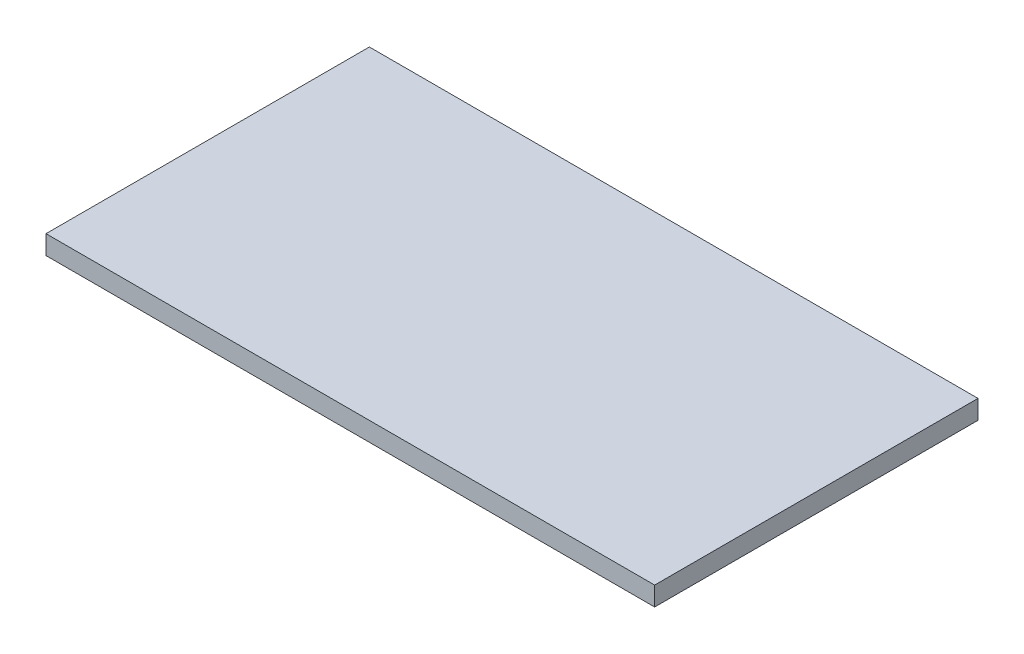
from build123d import *

# Parameters (mm, degrees)
SKIZZE1_W                       = 320
SKIZZE1_H                       = 170
AUFSATZ_LINEAR_AUSTRAGEN1_DEPTH = 10


with BuildPart() as part:
    # Skizze1 → Aufsatz-Linear austragen1 (new body)
    with BuildSketch(Plane(origin=(0, 0, 0), x_dir=(1, 0, 0), z_dir=(0, 1, 0))):
        Rectangle(SKIZZE1_W, SKIZZE1_H)
    extrude(amount=AUFSATZ_LINEAR_AUSTRAGEN1_DEPTH)


solid = part.part
